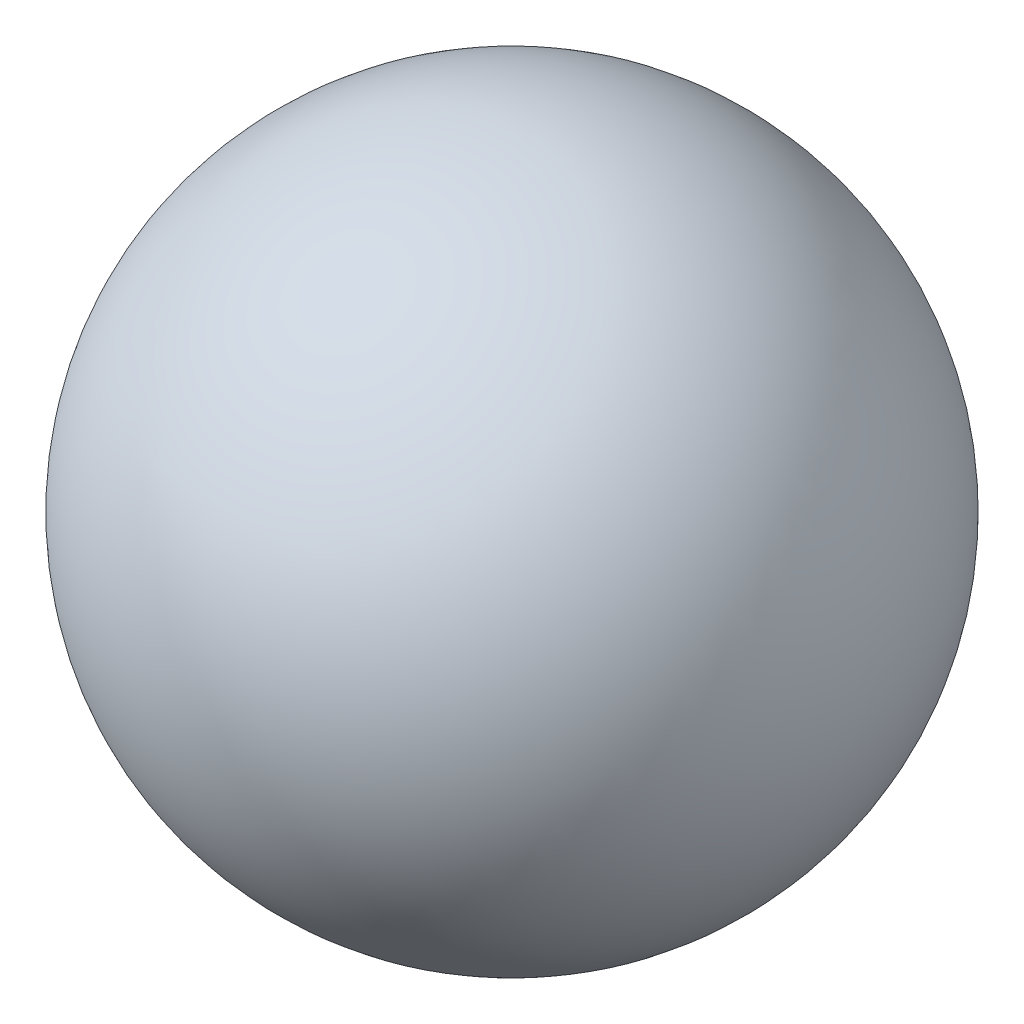
from build123d import *


with BuildPart() as part:
    # Sketch1 → Revolve3 (revolve)
    with BuildSketch(Plane(origin=(0, 0, 0), x_dir=(0, 0, -1), z_dir=(1, 0, 0))):
        with BuildLine():
            Line((0, 25), (0, -25))
            ThreePointArc((0, -25), (25, 0), (0, 25))
        make_face()
    revolve(axis=Axis((0, 25, 0), (0, -1, 0)))


solid = part.part
